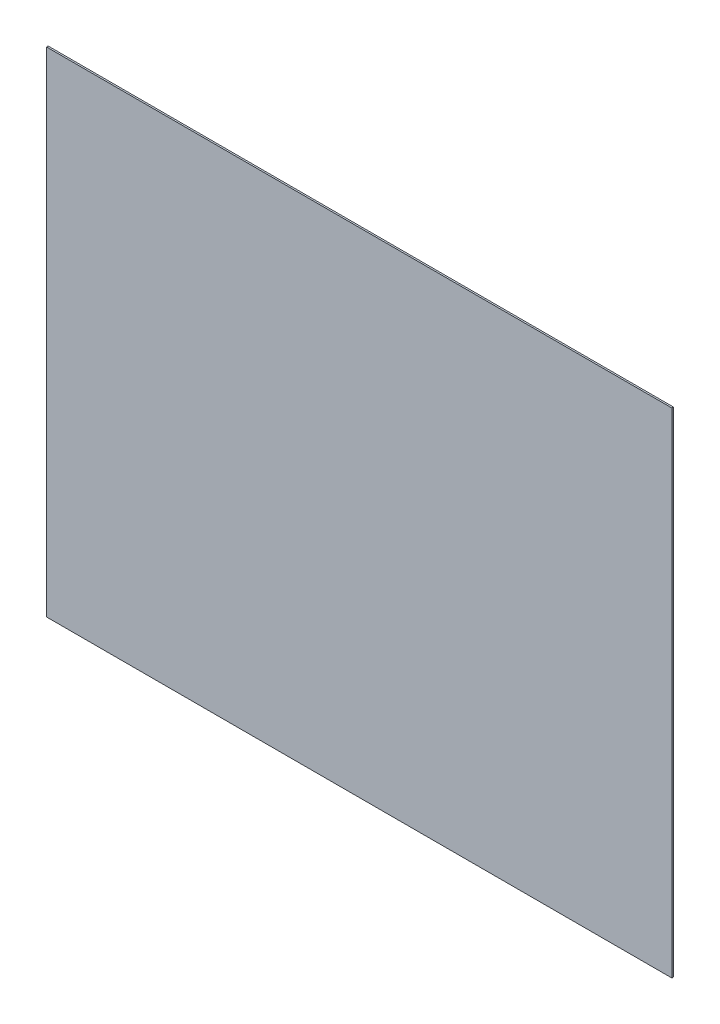
from build123d import *

# Parameters (mm, degrees)
CROQUIS1_W              = 380
CROQUIS1_H              = 300
SALIENTE_EXTRUIR1_DEPTH = 1


with BuildPart() as part:
    # Croquis1 → Saliente-Extruir1 (new body)
    with BuildSketch(Plane.XY):
        Rectangle(CROQUIS1_W, CROQUIS1_H)
    extrude(amount=SALIENTE_EXTRUIR1_DEPTH)


solid = part.part
